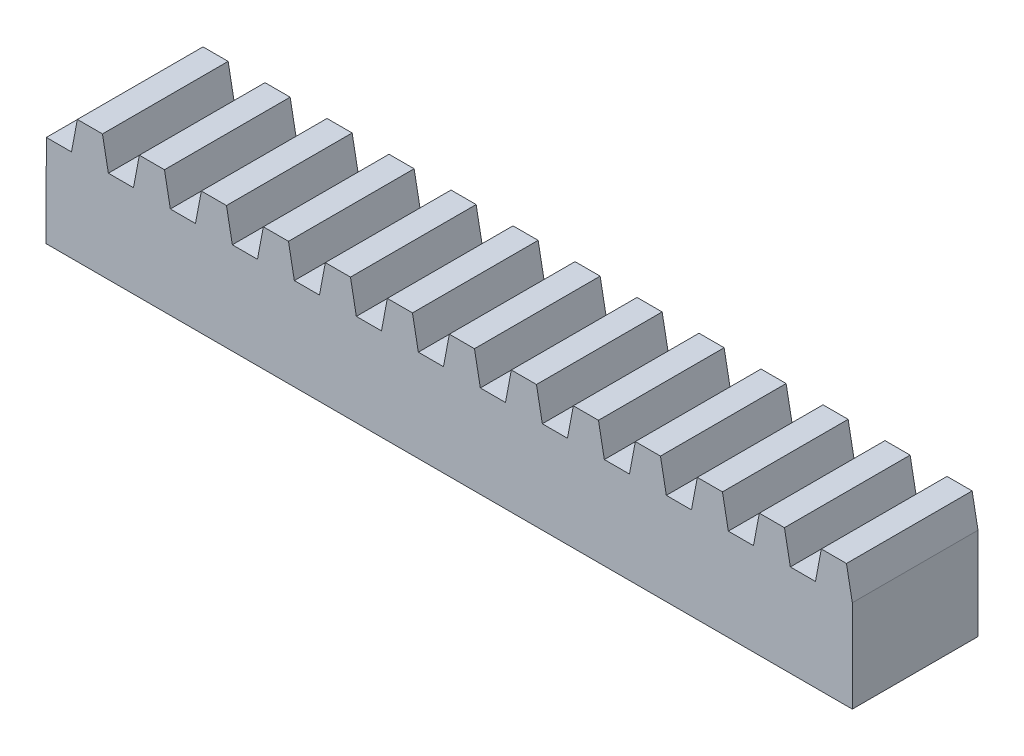
from build123d import *

# Parameters (mm, degrees)
EXTRUDE_4_DEPTH = 15


with BuildPart() as part:
    # Эскиз8 → Бобышка-Вытянуть4 (new body)
    with BuildSketch(Plane.XY):
        Polygon((0, 0), (0, 11), (-0.7, 14.71), (-3.7, 14.71), (-4.4, 11), (-7.4, 11), (-8.1, 14.71), (-11.1, 14.71), (-11.8, 11), (-14.8, 11), (-15.5, 14.71), (-18.5, 14.71), (-19.2, 11), (-22.2, 11), (-22.9, 14.71), (-25.9, 14.71), (-26.6, 11), (-29.6, 11), (-30.3, 14.71), (-33.3, 14.71), (-34, 11), (-37, 11), (-37.7, 14.71), (-40.7, 14.71), (-41.4, 11), (-44.4, 11), (-45.1, 14.71), (-48.1, 14.71), (-48.8, 11), (-51.8, 11), (-52.5, 14.71), (-55.5, 14.71), (-56.2, 11), (-59.2, 11), (-59.9, 14.71), (-62.9, 14.71), (-63.6, 11), (-66.6, 11), (-67.3, 14.71), (-70.3, 14.71), (-71, 11), (-74, 11), (-74.7, 14.71), (-77.7, 14.71), (-78.4, 11), (-81.4, 11), (-82.1, 14.71), (-85.1, 14.71), (-85.8, 11), (-88.8, 11), (-89.5, 14.71), (-92.5, 14.71), (-93.2, 11), (-96.2, 11), (-96.240718782, 0), align=None)
    extrude(amount=EXTRUDE_4_DEPTH)


solid = part.part
